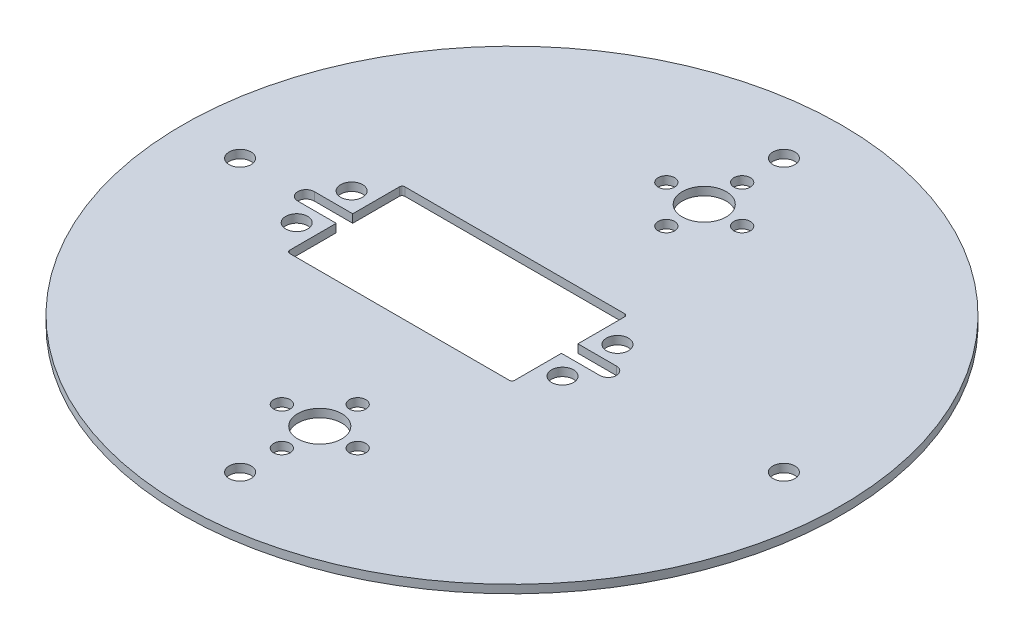
from build123d import *

# Parameters (mm, degrees)
SKETCH1_R           = 60
SKETCH1_R_2         = 2
SKETCH1_R_3         = 4
SKETCH1_R_4         = 1.5
BOSS_EXTRUDE1_DEPTH = 1.5


with BuildPart() as part:
    # Sketch1 → Boss-Extrude1 (new body)
    with BuildSketch(Plane(origin=(0, 0, 0), x_dir=(1, 0, 0), z_dir=(0, 1, 0))):
        with Locations(Location((0, 0, 0), (0, 0, 270))):
            Circle(SKETCH1_R)
        with Locations(Location((0, 49.5, 0), (0, 0, 270))):
            Circle(SKETCH1_R_2, mode=Mode.SUBTRACT)
        with Locations(Location((-49.5, 0, 0), (0, 0, 270))):
            Circle(SKETCH1_R_2, mode=Mode.SUBTRACT)
        with Locations(Location((0, -49.5, 0), (0, 0, 270))):
            Circle(SKETCH1_R_2, mode=Mode.SUBTRACT)
        with Locations(Location((49.5, 0, 0), (0, 0, 270))):
            Circle(SKETCH1_R_2, mode=Mode.SUBTRACT)
        with Locations(Location((0, 35, 0), (0, 0, 270))):
            Circle(SKETCH1_R_3, mode=Mode.SUBTRACT)
        with Locations(Location((0, 41.9, 0), (0, 0, 270))):
            Circle(SKETCH1_R_4, mode=Mode.SUBTRACT)
        with Locations(Location((6.9, 35, 0), (0, 0, 270))):
            Circle(SKETCH1_R_4, mode=Mode.SUBTRACT)
        with Locations(Location((0, 28.1, 0), (0, 0, 270))):
            Circle(SKETCH1_R_4, mode=Mode.SUBTRACT)
        with Locations(Location((-6.9, 35, 0), (0, 0, 270))):
            Circle(SKETCH1_R_4, mode=Mode.SUBTRACT)
        with Locations(Location((0, -35, 0), (0, 0, 90))):
            Circle(SKETCH1_R_3, mode=Mode.SUBTRACT)
        with Locations(Location((0, -28.1, 0), (0, 0, 90))):
            Circle(SKETCH1_R_4, mode=Mode.SUBTRACT)
        with Locations(Location((-6.9, -35, 0), (0, 0, 90))):
            Circle(SKETCH1_R_4, mode=Mode.SUBTRACT)
        with Locations(Location((0, -41.9, 0), (0, 0, 90))):
            Circle(SKETCH1_R_4, mode=Mode.SUBTRACT)
        with Locations(Location((6.9, -35, 0), (0, 0, 90))):
            Circle(SKETCH1_R_4, mode=Mode.SUBTRACT)
        with Locations(Location((-34.2, 5, 0), (0, 0, 270))):
            Circle(SKETCH1_R_2, mode=Mode.SUBTRACT)
        with Locations(Location((-34.2, -5, 0), (0, 0, 90))):
            Circle(SKETCH1_R_2, mode=Mode.SUBTRACT)
        with Locations(Location((14.2, 5, 0), (0, 0, 90))):
            Circle(SKETCH1_R_2, mode=Mode.SUBTRACT)
        with Locations(Location((14.2, -5, 0), (0, 0, 270))):
            Circle(SKETCH1_R_2, mode=Mode.SUBTRACT)
        with BuildLine():
            Line((-37.5, -1.5), (-30.5, -1.5))
            Line((-30.5, -1.5), (-30.5, -10))
            ThreePointArc((-30.5, -10), (-30.353553391, -10.353553391), (-30, -10.5))
            Line((-30, -10.5), (10, -10.5))
            ThreePointArc((10, -10.5), (10.353553391, -10.353553391), (10.5, -10))
            Line((10.5, -10), (10.5, -1.5))
            Line((10.5, -1.5), (17.5, -1.5))
            ThreePointArc((17.5, -1.5), (19, 0), (17.5, 1.5))
            Line((17.5, 1.5), (10.5, 1.5))
            Line((10.5, 1.5), (10.5, 10))
            ThreePointArc((10.5, 10), (10.353553391, 10.353553391), (10, 10.5))
            Line((10, 10.5), (-30, 10.5))
            ThreePointArc((-30, 10.5), (-30.353553391, 10.353553391), (-30.5, 10))
            Line((-30.5, 10), (-30.5, 1.5))
            Line((-30.5, 1.5), (-37.5, 1.5))
            ThreePointArc((-37.5, 1.5), (-39, 0), (-37.5, -1.5))
        make_face(mode=Mode.SUBTRACT)
    extrude(amount=BOSS_EXTRUDE1_DEPTH)


solid = part.part
